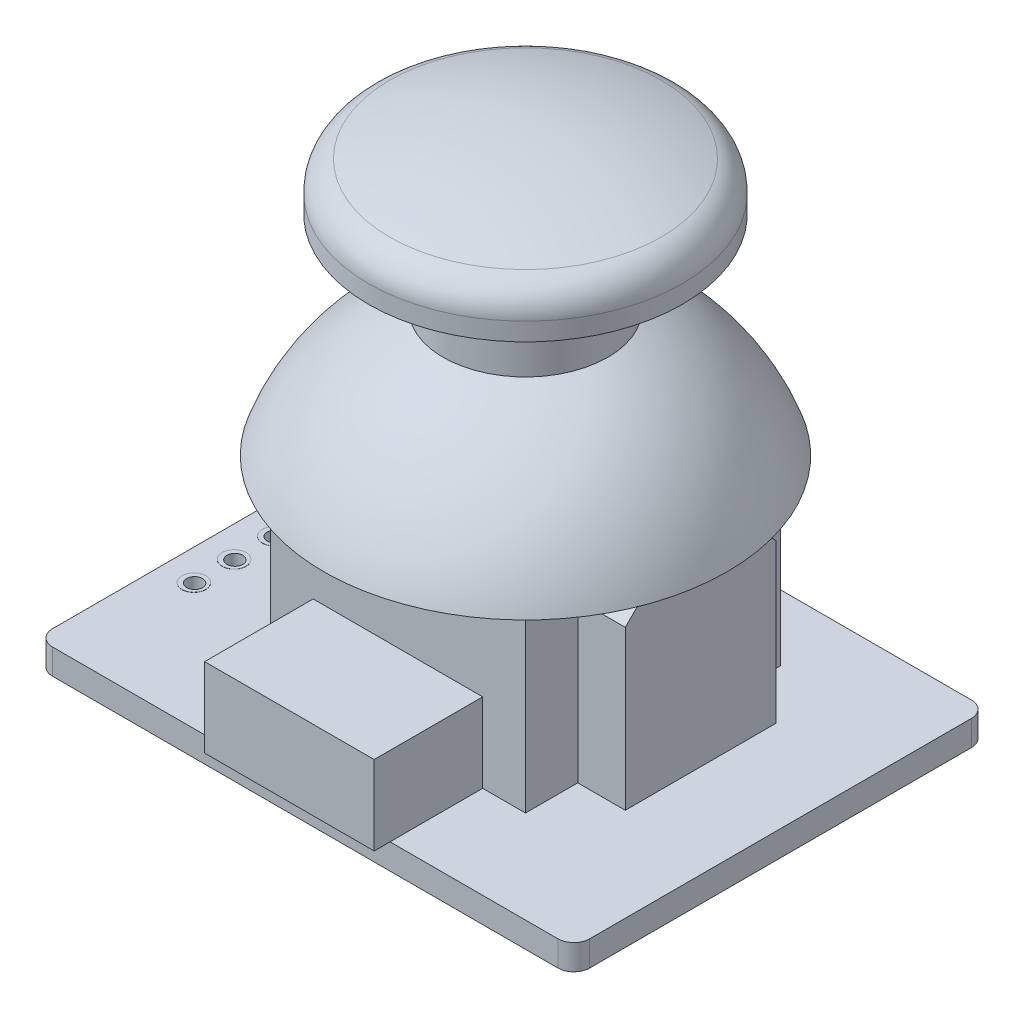
from build123d import *

# Parameters (mm, degrees)
SKETCH1_W                       = 33.9
SKETCH1_H                       = 26.1
PCB_EXT_DEPTH                   = 1.6
FILLET1_R                       = 1
SKETCH14_R                      = 0.5
CUT_EXTRUDE1_DEPTH              = 22.451456827
BOSS_EXTRUDE6_START             = 0.01
SKETCH15_R                      = 0.75
SKETCH15_R_2                    = 0.5
BOSS_EXTRUDE6_DEPTH             = 0.01
LPATTERN1_COUNT                 = 3
LPATTERN1_PITCH                 = 2.54
LPATTERN1_START                 = 0.01
LPATTERN1_COPY_1_SKETCH_R       = 0.75
LPATTERN1_COPY_1_SKETCH_R_2     = 0.5
LPATTERN1_COPY_1_DEPTH          = 0.01
LPATTERN1_COPY_2_SKETCH_R       = 0.75
LPATTERN1_COPY_2_SKETCH_R_2     = 0.5
LPATTERN1_COPY_2_DEPTH          = 0.01
LPATTERN1_COL_COUNT             = 3
LPATTERN1_COL_PITCH             = 2.54
LPATTERN1_COL_COPY_1_SKETCH_R   = 0.75
LPATTERN1_COL_COPY_1_SKETCH_R_2 = 0.5
LPATTERN1_COL_COPY_1_DEPTH      = 0.01
LPATTERN1_COL_COPY_2_SKETCH_R   = 0.75
LPATTERN1_COL_COPY_2_SKETCH_R_2 = 0.5
LPATTERN1_COL_COPY_2_DEPTH      = 0.01
SKETCH2_W                       = 16.1
SKETCH2_H                       = 16.1
HAT_BOX_DEPTH                   = 12
SKETCH10_W                      = 3
SKETCH10_H                      = 9.5
BOSS_EXTRUDE5_DEPTH             = 12
CHAMFER1_SIZE                   = 2
CIRPATTERN1_COUNT               = 2
CIRPATTERN1_ANGLE               = 90
SKETCH3_W                       = 10.7
SKETCH3_H                       = 6.85
HAT_PUSH_BUTTON_DEPTH           = 5
SKETCH4_R                       = 2
BOSS_EXTRUDE4_DEPTH             = 7.5
FILLET2_R                       = 2


with BuildPart() as part:
    # Sketch1 → PCB ext (new body)
    with BuildSketch(Plane(origin=(0, 0, 0), x_dir=(1, 0, 0), z_dir=(0, 1, 0))):
        Rectangle(SKETCH1_W, SKETCH1_H)
    extrude(amount=PCB_EXT_DEPTH)

    # Fillet1
    fillet1_edges = [part.edges().sort_by_distance(p)[0] for p in [
        (16.95, 0.8, 13.05),
        (-16.95, 0.8, 13.05),
        (-16.95, 0.8, -13.05),
        (16.95, 0.8, -13.05),
    ]]
    fillet(fillet1_edges, radius=FILLET1_R)

    # Sketch14 → Cut-Extrude1 (cut, through all)
    with BuildSketch(Plane(origin=(0, 1.6, 0), x_dir=(1, 0, 0), z_dir=(0, 1, 0))):
        with Locations(Location((-14.95, 0, 0), (0, 0, 270))):
            Circle(SKETCH14_R)
    cut_extrude1 = extrude(amount=-CUT_EXTRUDE1_DEPTH, mode=Mode.SUBTRACT)

    # Sketch15 → Boss-Extrude6 (add)
    with BuildSketch(Plane(origin=(0, 1.6, 0), x_dir=(1, 0, 0), z_dir=(0, 1, 0)).offset(BOSS_EXTRUDE6_START)):
        with Locations(Location((-15, 0, 0), (0, 0, 90))):
            Circle(SKETCH15_R)
        with Locations(Location((-14.95, 0, 0), (0, 0, 270))):
            Circle(SKETCH15_R_2, mode=Mode.SUBTRACT)
    boss_extrude6 = extrude(amount=-BOSS_EXTRUDE6_DEPTH)

    # Mirror1: Boss-Extrude6 across plane
    add(boss_extrude6.mirror(Plane.ZX.offset(0.8)))

    # LPattern1: Cut-Extrude1, Boss-Extrude6 ×3
    with Locations(*[(0, 0, i * LPATTERN1_PITCH) for i in range(1, LPATTERN1_COUNT)]):
        add(cut_extrude1, mode=Mode.SUBTRACT)
        add(boss_extrude6)

    # LPattern1 copy 1 sketch → LPattern1 copy 1 (add)
    with BuildSketch(Plane(origin=(0, 0, 2.54), x_dir=(1, 0, 0), z_dir=(0, -1, 0)).offset(LPATTERN1_START)):
        with Locations((-15, 0)):
            Circle(LPATTERN1_COPY_1_SKETCH_R)
        with Locations((-14.95, 0)):
            Circle(LPATTERN1_COPY_1_SKETCH_R_2, mode=Mode.SUBTRACT)
    extrude(amount=-LPATTERN1_COPY_1_DEPTH)

    # LPattern1 copy 2 sketch → LPattern1 copy 2 (add)
    with BuildSketch(Plane(origin=(0, 0, 5.08), x_dir=(1, 0, 0), z_dir=(0, -1, 0)).offset(LPATTERN1_START)):
        with Locations((-15, 0)):
            Circle(LPATTERN1_COPY_2_SKETCH_R)
        with Locations((-14.95, 0)):
            Circle(LPATTERN1_COPY_2_SKETCH_R_2, mode=Mode.SUBTRACT)
    extrude(amount=-LPATTERN1_COPY_2_DEPTH)

    # LPattern1 col: Cut-Extrude1, Boss-Extrude6 ×3
    with Locations(*[(0, 0, -i * LPATTERN1_COL_PITCH) for i in range(1, LPATTERN1_COL_COUNT)]):
        add(cut_extrude1, mode=Mode.SUBTRACT)
        add(boss_extrude6)

    # LPattern1 col copy 1 sketch → LPattern1 col copy 1 (add)
    with BuildSketch(Plane(origin=(0, 0, -2.54), x_dir=(1, 0, 0), z_dir=(0, -1, 0)).offset(LPATTERN1_START)):
        with Locations((-15, 0)):
            Circle(LPATTERN1_COL_COPY_1_SKETCH_R)
        with Locations((-14.95, 0)):
            Circle(LPATTERN1_COL_COPY_1_SKETCH_R_2, mode=Mode.SUBTRACT)
    extrude(amount=-LPATTERN1_COL_COPY_1_DEPTH)

    # LPattern1 col copy 2 sketch → LPattern1 col copy 2 (add)
    with BuildSketch(Plane(origin=(0, 0, -5.08), x_dir=(1, 0, 0), z_dir=(0, -1, 0)).offset(LPATTERN1_START)):
        with Locations((-15, 0)):
            Circle(LPATTERN1_COL_COPY_2_SKETCH_R)
        with Locations((-14.95, 0)):
            Circle(LPATTERN1_COL_COPY_2_SKETCH_R_2, mode=Mode.SUBTRACT)
    extrude(amount=-LPATTERN1_COL_COPY_2_DEPTH)


with BuildPart() as body_2:
    # Sketch2 → Hat box (new body)
    with BuildSketch(Plane(origin=(0, 1.6, 0), x_dir=(1, 0, 0), z_dir=(0, 1, 0))):
        with Locations((0, 0.85)):
            Rectangle(SKETCH2_W, SKETCH2_H)
    extrude(amount=HAT_BOX_DEPTH)

    # Sketch3 → Hat push button (add)
    with BuildSketch(Plane(origin=(0, 1.6, 0), x_dir=(1, 0, 0), z_dir=(0, 1, 0))):
        with Locations((0, -10.625)):
            Rectangle(SKETCH3_W, SKETCH3_H)
    extrude(amount=HAT_PUSH_BUTTON_DEPTH)

    # Sketch4 → Boss-Extrude4 (add)
    with BuildSketch(Plane(origin=(0, 13.6, 0), x_dir=(1, 0, 0), z_dir=(0, 1, 0))):
        with Locations(Location((0, 0.85, 0), (0, 0, 270))):
            Circle(SKETCH4_R)
    extrude(amount=BOSS_EXTRUDE4_DEPTH)


with BuildPart() as body_3:
    # Sketch10 → Boss-Extrude5 (new body)
    with BuildSketch(Plane(origin=(0, 1.6, 0), x_dir=(1, 0, 0), z_dir=(0, 1, 0))):
        with Locations((9.55, 0.85)):
            Rectangle(SKETCH10_W, SKETCH10_H)
    extrude(amount=BOSS_EXTRUDE5_DEPTH)

    # Chamfer1
    chamfer1_edges = [body_3.edges().sort_by_distance(p)[0] for p in [
        (9.55, 13.6, -5.6),
        (9.55, 13.6, 3.9),
    ]]
    chamfer(chamfer1_edges, length=CHAMFER1_SIZE)


with BuildPart() as cirpattern1_1:
    # CirPattern1: pattern copy
    add(body_3.part.rotate(Axis((0, 0, -0.85), (0, 1, 0)), 1 * CIRPATTERN1_ANGLE / (CIRPATTERN1_COUNT - 1)))


with BuildPart() as body_5:
    # Sketch9 → Revolve1 (revolve)
    with BuildSketch(Plane.XY.offset(-0.85)):
        with BuildLine():
            Line((0, 20.73260071), (0, 30.8))
            ThreePointArc((0, 30.8), (5.05, 30.295), (9.9, 28.8))
            Line((9.9, 28.8), (9.9, 26.3))
            Line((9.9, 26.3), (5.2, 26.3))
            Line((5.2, 26.3), (5.2, 21.058330546))
            ThreePointArc((5.2, 21.058330546), (9.807464179, 17.877049443), (12.727922061, 13.1))
            Line((12.727922061, 13.1), (12.409270728, 13.1))
            ThreePointArc((12.409270728, 13.1), (9.596132153, 17.663898041), (5.2, 20.73260071))
            Line((5.2, 20.73260071), (0, 20.73260071))
        make_face()
    revolve(axis=Axis((0, -961.886040234, -0.85), (0, 1, 0)))

    # Fillet2
    fillet2_edges = [body_5.edges().sort_by_distance(p)[0] for p in [
        (-9.9, 28.8, -0.85),
    ]]
    fillet(fillet2_edges, radius=FILLET2_R)


solid = Compound([part.part, body_2.part, body_3.part, cirpattern1_1.part, body_5.part])
